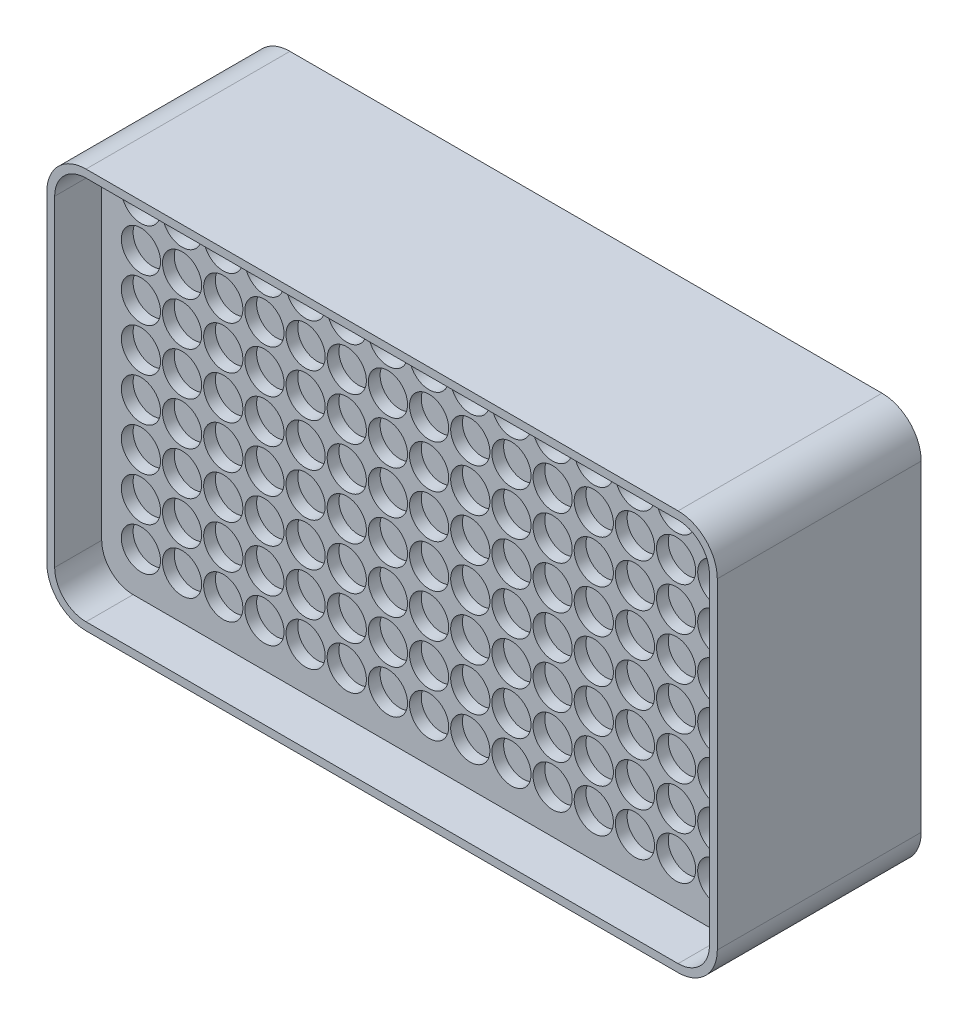
from build123d import *

# Parameters (mm, degrees)
SKETCH1_W           = 171
SKETCH1_H           = 102
BOSS_EXTRUDE1_DEPTH = 40
FILLET1_R           = 10
SKETCH3_R           = 5
CUT_EXTRUDE1_DEPTH  = 3
BOSS_EXTRUDE4_START = 12
BOSS_EXTRUDE4_DEPTH = 12


with BuildPart() as part:
    # Sketch1 → Boss-Extrude1 (new body)
    with BuildSketch(Plane.XY):
        Rectangle(SKETCH1_W, SKETCH1_H)
    extrude(amount=BOSS_EXTRUDE1_DEPTH)

    # Fillet1
    fillet1_edges = [part.edges().sort_by_distance(p)[0] for p in [
        (-85.5, 51, 20),
        (85.5, 51, 20),
        (85.5, -51, 20),
        (-85.5, -51, 20),
    ]]
    fillet(fillet1_edges, radius=FILLET1_R)

    # Sketch3 → Cut-Extrude1 (cut)
    with BuildSketch(Plane.XY.offset(40)):
        with Locations((-73.5, 39)):
            Circle(SKETCH3_R)
        with Locations((-63, 39)):
            Circle(SKETCH3_R)
        with Locations((-52.5, 39)):
            Circle(SKETCH3_R)
        with Locations((-42, 39)):
            Circle(SKETCH3_R)
        with Locations((-31.5, 39)):
            Circle(SKETCH3_R)
        with Locations((-21, 39)):
            Circle(SKETCH3_R)
        with Locations((-10.5, 39)):
            Circle(SKETCH3_R)
        with Locations((0, 39)):
            Circle(SKETCH3_R)
        with Locations((10.5, 39)):
            Circle(SKETCH3_R)
        with Locations((21, 39)):
            Circle(SKETCH3_R)
        with Locations((31.5, 39)):
            Circle(SKETCH3_R)
        with Locations((42, 39)):
            Circle(SKETCH3_R)
        with Locations((52.5, 39)):
            Circle(SKETCH3_R)
        with Locations((63, 39)):
            Circle(SKETCH3_R)
        with Locations((73.5, 39)):
            Circle(SKETCH3_R)
        with Locations((-63, 28)):
            Circle(SKETCH3_R)
        with Locations((-52.5, 28)):
            Circle(SKETCH3_R)
        with Locations((-42, 28)):
            Circle(SKETCH3_R)
        with Locations((-31.5, 28)):
            Circle(SKETCH3_R)
        with Locations((-21, 28)):
            Circle(SKETCH3_R)
        with Locations((-10.5, 28)):
            Circle(SKETCH3_R)
        with Locations((0, 28)):
            Circle(SKETCH3_R)
        with Locations((10.5, 28)):
            Circle(SKETCH3_R)
        with Locations((21, 28)):
            Circle(SKETCH3_R)
        with Locations((31.5, 28)):
            Circle(SKETCH3_R)
        with Locations((42, 28)):
            Circle(SKETCH3_R)
        with Locations((52.5, 28)):
            Circle(SKETCH3_R)
        with Locations((63, 28)):
            Circle(SKETCH3_R)
        with Locations((73.5, 28)):
            Circle(SKETCH3_R)
        with Locations((-63, 17)):
            Circle(SKETCH3_R)
        with Locations((-52.5, 17)):
            Circle(SKETCH3_R)
        with Locations((-42, 17)):
            Circle(SKETCH3_R)
        with Locations((-31.5, 17)):
            Circle(SKETCH3_R)
        with Locations((-21, 17)):
            Circle(SKETCH3_R)
        with Locations((-10.5, 17)):
            Circle(SKETCH3_R)
        with Locations((0, 17)):
            Circle(SKETCH3_R)
        with Locations((10.5, 17)):
            Circle(SKETCH3_R)
        with Locations((21, 17)):
            Circle(SKETCH3_R)
        with Locations((31.5, 17)):
            Circle(SKETCH3_R)
        with Locations((42, 17)):
            Circle(SKETCH3_R)
        with Locations((52.5, 17)):
            Circle(SKETCH3_R)
        with Locations((63, 17)):
            Circle(SKETCH3_R)
        with Locations((73.5, 17)):
            Circle(SKETCH3_R)
        with Locations((-63, 6)):
            Circle(SKETCH3_R)
        with Locations((-52.5, 6)):
            Circle(SKETCH3_R)
        with Locations((-42, 6)):
            Circle(SKETCH3_R)
        with Locations((-31.5, 6)):
            Circle(SKETCH3_R)
        with Locations((-21, 6)):
            Circle(SKETCH3_R)
        with Locations((-10.5, 6)):
            Circle(SKETCH3_R)
        with Locations((0, 6)):
            Circle(SKETCH3_R)
        with Locations((10.5, 6)):
            Circle(SKETCH3_R)
        with Locations((21, 6)):
            Circle(SKETCH3_R)
        with Locations((31.5, 6)):
            Circle(SKETCH3_R)
        with Locations((42, 6)):
            Circle(SKETCH3_R)
        with Locations((52.5, 6)):
            Circle(SKETCH3_R)
        with Locations((63, 6)):
            Circle(SKETCH3_R)
        with Locations((73.5, 6)):
            Circle(SKETCH3_R)
        with Locations((-63, -5)):
            Circle(SKETCH3_R)
        with Locations((-52.5, -5)):
            Circle(SKETCH3_R)
        with Locations((-42, -5)):
            Circle(SKETCH3_R)
        with Locations((-31.5, -5)):
            Circle(SKETCH3_R)
        with Locations((-21, -5)):
            Circle(SKETCH3_R)
        with Locations((-10.5, -5)):
            Circle(SKETCH3_R)
        with Locations((0, -5)):
            Circle(SKETCH3_R)
        with Locations((10.5, -5)):
            Circle(SKETCH3_R)
        with Locations((21, -5)):
            Circle(SKETCH3_R)
        with Locations((31.5, -5)):
            Circle(SKETCH3_R)
        with Locations((42, -5)):
            Circle(SKETCH3_R)
        with Locations((52.5, -5)):
            Circle(SKETCH3_R)
        with Locations((63, -5)):
            Circle(SKETCH3_R)
        with Locations((73.5, -5)):
            Circle(SKETCH3_R)
        with Locations((-63, -16)):
            Circle(SKETCH3_R)
        with Locations((-52.5, -16)):
            Circle(SKETCH3_R)
        with Locations((-42, -16)):
            Circle(SKETCH3_R)
        with Locations((-31.5, -16)):
            Circle(SKETCH3_R)
        with Locations((-21, -16)):
            Circle(SKETCH3_R)
        with Locations((-10.5, -16)):
            Circle(SKETCH3_R)
        with Locations((0, -16)):
            Circle(SKETCH3_R)
        with Locations((10.5, -16)):
            Circle(SKETCH3_R)
        with Locations((21, -16)):
            Circle(SKETCH3_R)
        with Locations((31.5, -16)):
            Circle(SKETCH3_R)
        with Locations((42, -16)):
            Circle(SKETCH3_R)
        with Locations((52.5, -16)):
            Circle(SKETCH3_R)
        with Locations((63, -16)):
            Circle(SKETCH3_R)
        with Locations((73.5, -16)):
            Circle(SKETCH3_R)
        with Locations((-63, -27)):
            Circle(SKETCH3_R)
        with Locations((-52.5, -27)):
            Circle(SKETCH3_R)
        with Locations((-42, -27)):
            Circle(SKETCH3_R)
        with Locations((-31.5, -27)):
            Circle(SKETCH3_R)
        with Locations((-21, -27)):
            Circle(SKETCH3_R)
        with Locations((-10.5, -27)):
            Circle(SKETCH3_R)
        with Locations((0, -27)):
            Circle(SKETCH3_R)
        with Locations((10.5, -27)):
            Circle(SKETCH3_R)
        with Locations((21, -27)):
            Circle(SKETCH3_R)
        with Locations((31.5, -27)):
            Circle(SKETCH3_R)
        with Locations((42, -27)):
            Circle(SKETCH3_R)
        with Locations((52.5, -27)):
            Circle(SKETCH3_R)
        with Locations((63, -27)):
            Circle(SKETCH3_R)
        with Locations((73.5, -27)):
            Circle(SKETCH3_R)
        with Locations((-63, -38)):
            Circle(SKETCH3_R)
        with Locations((-52.5, -38)):
            Circle(SKETCH3_R)
        with Locations((-42, -38)):
            Circle(SKETCH3_R)
        with Locations((-31.5, -38)):
            Circle(SKETCH3_R)
        with Locations((-21, -38)):
            Circle(SKETCH3_R)
        with Locations((-10.5, -38)):
            Circle(SKETCH3_R)
        with Locations((0, -38)):
            Circle(SKETCH3_R)
        with Locations((10.5, -38)):
            Circle(SKETCH3_R)
        with Locations((21, -38)):
            Circle(SKETCH3_R)
        with Locations((31.5, -38)):
            Circle(SKETCH3_R)
        with Locations((42, -38)):
            Circle(SKETCH3_R)
        with Locations((52.5, -38)):
            Circle(SKETCH3_R)
        with Locations((63, -38)):
            Circle(SKETCH3_R)
        with Locations((73.5, -38)):
            Circle(SKETCH3_R)
        with Locations((-73.5, 28)):
            Circle(SKETCH3_R)
        with Locations((-73.5, 17)):
            Circle(SKETCH3_R)
        with Locations((-73.5, 6)):
            Circle(SKETCH3_R)
        with Locations((-73.5, -5)):
            Circle(SKETCH3_R)
        with Locations((-73.5, -16)):
            Circle(SKETCH3_R)
        with Locations((-73.5, -27)):
            Circle(SKETCH3_R)
        with Locations((-73.5, -38)):
            Circle(SKETCH3_R)
    extrude(amount=-CUT_EXTRUDE1_DEPTH, mode=Mode.SUBTRACT)

    # Sketch5 → Boss-Extrude4 (add)
    with BuildSketch(Plane.XY.offset(40).offset(BOSS_EXTRUDE4_START)):
        with BuildLine():
            Line((-75.5, 51), (75.5, 51))
            ThreePointArc((75.5, 51), (82.571067812, 48.071067812), (85.5, 41))
            Line((85.5, 41), (85.5, -41))
            ThreePointArc((85.5, -41), (82.571067812, -48.071067812), (75.5, -51))
            Line((75.5, -51), (-75.5, -51))
            ThreePointArc((-75.5, -51), (-82.571067812, -48.071067812), (-85.5, -41))
            Line((-85.5, -41), (-85.5, 41))
            ThreePointArc((-85.5, 41), (-82.571067812, 48.071067812), (-75.5, 51))
        make_face()
        with BuildLine():
            Line((-75.5, 49), (75.5, 49))
            ThreePointArc((75.5, 49), (81.156854249, 46.656854249), (83.5, 41))
            Line((83.5, 41), (83.5, -41))
            ThreePointArc((83.5, -41), (81.156854249, -46.656854249), (75.5, -49))
            Line((75.5, -49), (-75.5, -49))
            ThreePointArc((-75.5, -49), (-81.156854249, -46.656854249), (-83.5, -41))
            Line((-83.5, -41), (-83.5, 41))
            ThreePointArc((-83.5, 41), (-81.156854249, 46.656854249), (-75.5, 49))
        make_face(mode=Mode.SUBTRACT)
    extrude(amount=-BOSS_EXTRUDE4_DEPTH)


solid = part.part
